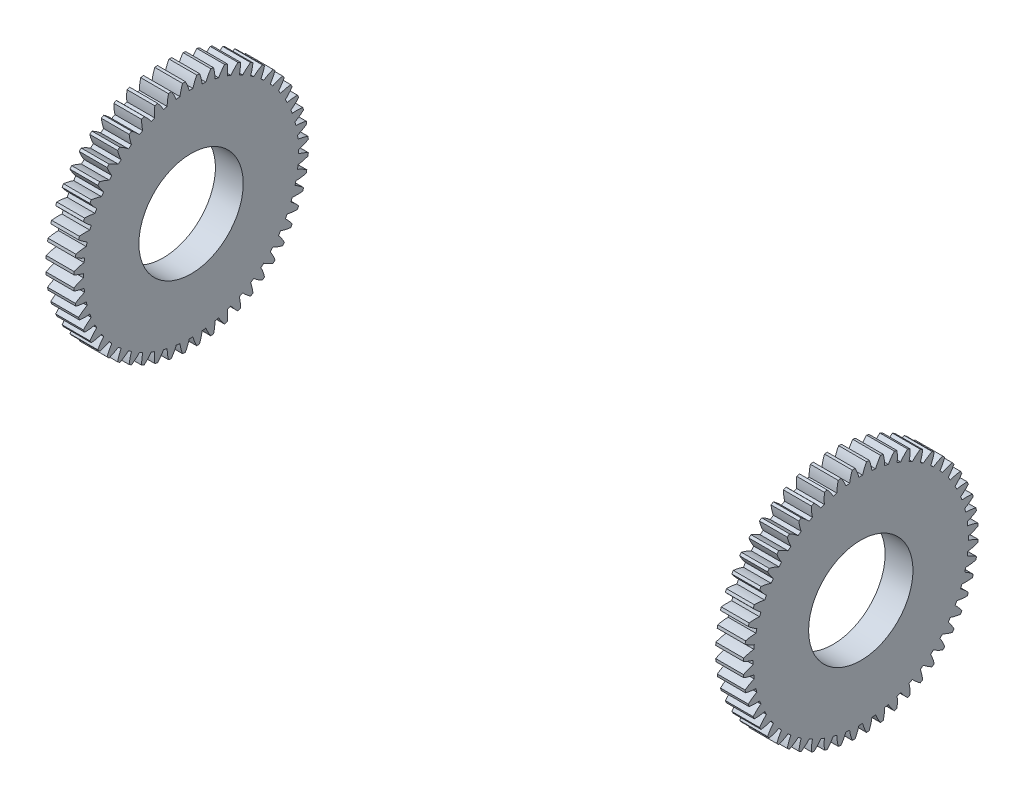
from build123d import *

# Parameters (mm, degrees)
BASPROSKE_W     = 5.08
BASPROSKE_H     = 21.43125
TOOTHCUT_DEPTH  = 71.5247428
TEETHCUTS_COUNT = 52
TEETHCUTS_ANGLE = 353.076923077
BORSKE_R        = 9.525
BORE_DEPTH      = 50.8000508


with BuildPart() as part:
    # BasProSke → Base-Revolve (revolve)
    with BuildSketch(Plane(origin=(0, 0, 0), x_dir=(1, 0, 0), z_dir=(0, 1, 0)), mode=Mode.PRIVATE) as base_revolve_sk:
        with Locations((61.139999952, 10.715625)):
            Rectangle(BASPROSKE_W, BASPROSKE_H)
    revolve(base_revolve_sk.sketch.rotate(Axis((-10, 0, 0), (1, 0, 0)), 180), axis=Axis((-10, 0, 0), (1, 0, 0)))

    # TooCutSke → ToothCut (cut, through all)
    with BuildSketch(Plane(origin=(0, 0, 0), x_dir=(0, 0, -1), z_dir=(1, 0, 0))):
        with BuildLine():
            ThreePointArc((0.340444385, 19.631248235), (0, 19.6342), (-0.340444385, 19.631248235))
            ThreePointArc((-0.340444385, 19.631248235), (-0.64320584, 20.551967762), (-1.051795873, 21.430855201))
            ThreePointArc((-1.051795873, 21.430855201), (0, 21.45665), (1.051795873, 21.430855201))
            ThreePointArc((1.051795873, 21.430855201), (0.64320584, 20.551967762), (0.340444385, 19.631248235))
        make_face()
    toothcut = extrude(amount=TOOTHCUT_DEPTH, mode=Mode.SUBTRACT)

    # TeethCuts: ToothCut ×52 about axis
    teethcuts_axis = Axis((-10, 0, 0), (1, 0, 0))
    for i in range(1, TEETHCUTS_COUNT):
        add(toothcut.rotate(teethcuts_axis, i * TEETHCUTS_ANGLE / (TEETHCUTS_COUNT - 1)), mode=Mode.SUBTRACT)

    # BorSke → Bore (cut, symmetric)
    with BuildSketch(Plane(origin=(58.599999952, 0, 0), x_dir=(0, 0, -1), z_dir=(1, 0, 0))):
        with Locations(Location((0, 0, 0), (0, 0, 180))):
            Circle(BORSKE_R)
    extrude(amount=BORE_DEPTH, both=True, mode=Mode.SUBTRACT)


with BuildPart() as body_2:
    # Mirror1: mirrored copy
    add(part.part.mirror(Plane(origin=(0, 0, 0), x_dir=(0, 0, 1), z_dir=(1, 0, 0))))


solid = Compound([part.part, body_2.part])
